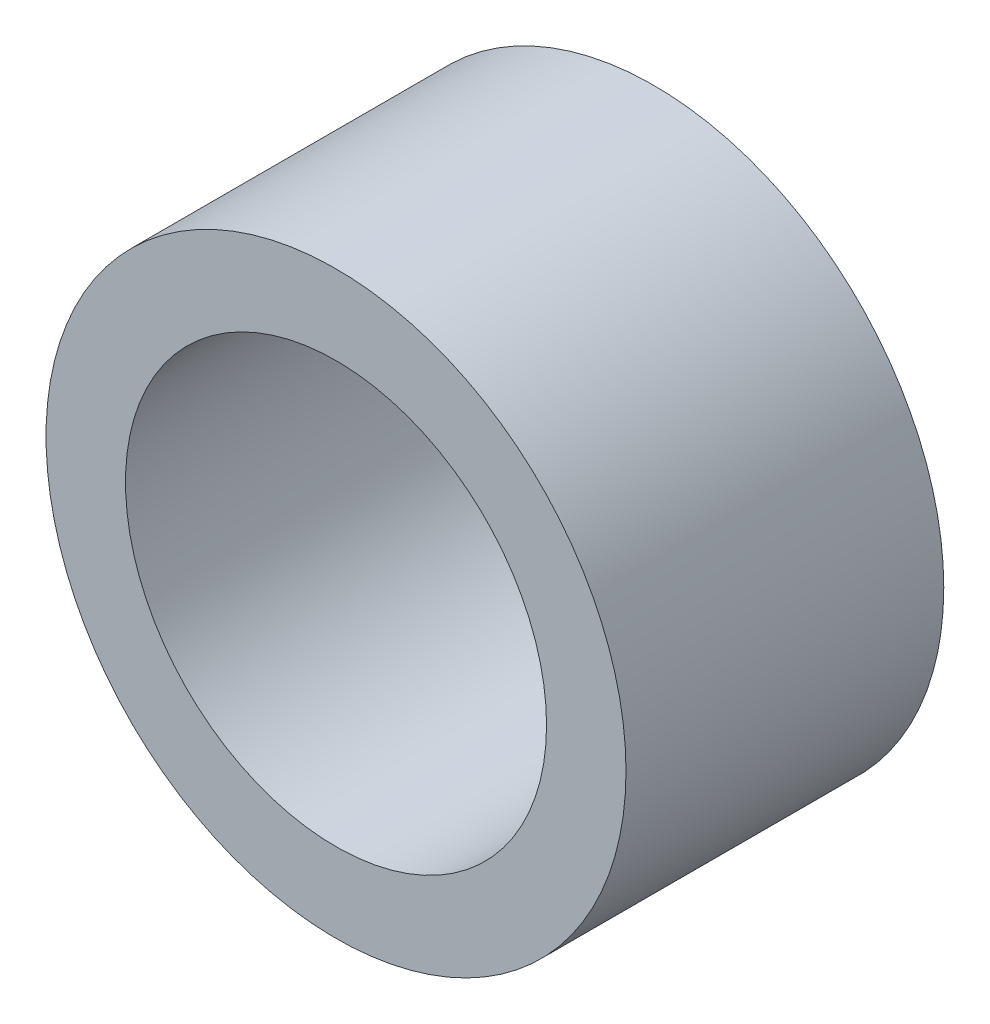
from build123d import *

# Parameters (mm, degrees)
ESQUISSE1_R        = 7.3
ESQUISSE1_R_2      = 5.3
BOSS_EXTRU_1_DEPTH = 8


with BuildPart() as part:
    # Esquisse1 → Boss.-Extru.1 (new body)
    with BuildSketch(Plane.XY):
        Circle(ESQUISSE1_R)
        Circle(ESQUISSE1_R_2, mode=Mode.SUBTRACT)
    extrude(amount=BOSS_EXTRU_1_DEPTH)


solid = part.part
